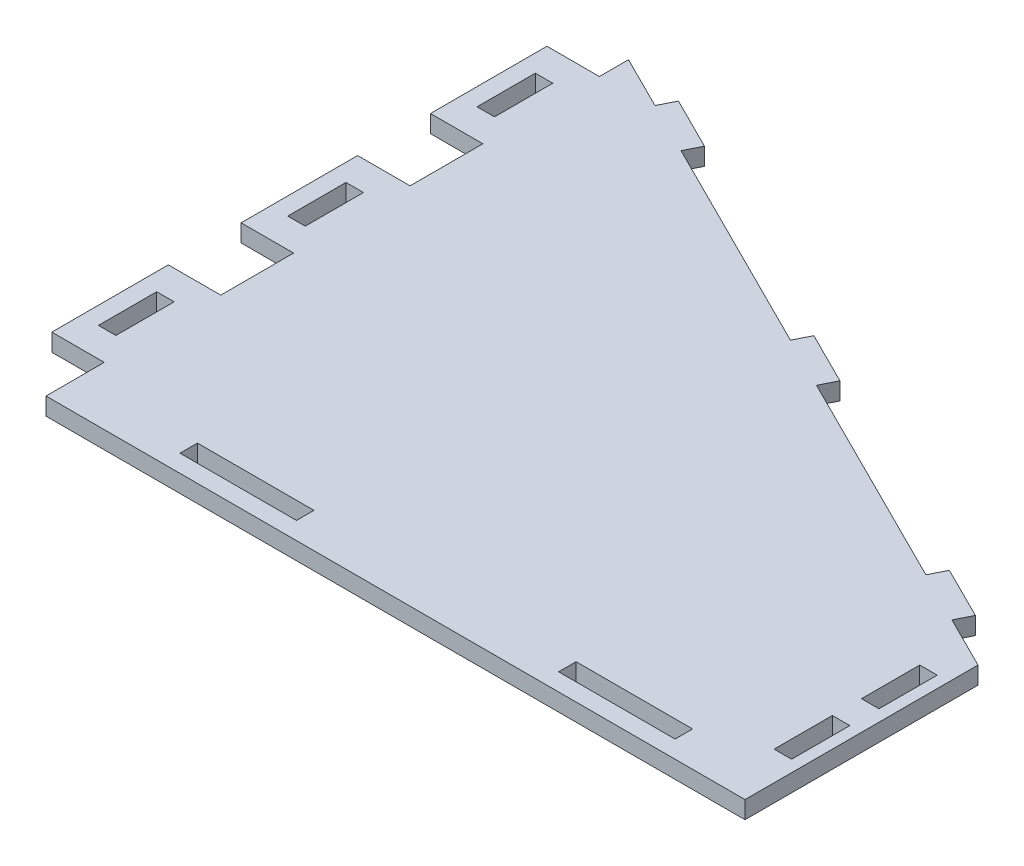
from build123d import *

# Parameters (mm, degrees)
SKETCH1_W           = 3
SKETCH1_H           = 10
SKETCH1_W_2         = 20
SKETCH1_H_2         = 3
BOSS_EXTRUDE1_DEPTH = 3


with BuildPart() as part:
    # Sketch1 → Boss-Extrude1 (new body)
    with BuildSketch(Plane(origin=(0, 0, 0), x_dir=(1, 0, 0), z_dir=(0, 1, 0))):
        Polygon((0, 0), (0, 10), (-9, 10), (-9, 30), (0, 30), (0, 42.5), (-9, 42.5), (-9, 62.5), (0, 62.5), (0, 75), (-9, 75), (-9, 95), (0, 95), (0, 100), (9.091028316, 95.454485842), (10.432669103, 98.137767415), (19.376941013, 93.66563146), (18.035300226, 90.982349887), (55.601242248, 72.199378876), (56.942883035, 74.882660449), (65.887154945, 70.410524494), (64.545514158, 67.727242921), (102.11145618, 48.94427191), (103.453096967, 51.627553483), (112.397368877, 47.155417528), (111.05572809, 44.472135955), (120, 40), (120, 0), align=None)
        with Locations((116.5, 30)):
            Rectangle(SKETCH1_W, SKETCH1_H, mode=Mode.SUBTRACT)
        with Locations((116.5, 15)):
            Rectangle(SKETCH1_W, SKETCH1_H, mode=Mode.SUBTRACT)
        with Locations((30, 4.5)):
            Rectangle(SKETCH1_W_2, SKETCH1_H_2, mode=Mode.SUBTRACT)
        with Locations((95, 4.5)):
            Rectangle(SKETCH1_W_2, SKETCH1_H_2, mode=Mode.SUBTRACT)
        with Locations((-4.5, 85)):
            Rectangle(SKETCH1_W, SKETCH1_H, mode=Mode.SUBTRACT)
        with Locations((-4.5, 52.5)):
            Rectangle(SKETCH1_W, SKETCH1_H, mode=Mode.SUBTRACT)
        with Locations((-4.5, 20)):
            Rectangle(SKETCH1_W, SKETCH1_H, mode=Mode.SUBTRACT)
    extrude(amount=BOSS_EXTRUDE1_DEPTH)


solid = part.part
